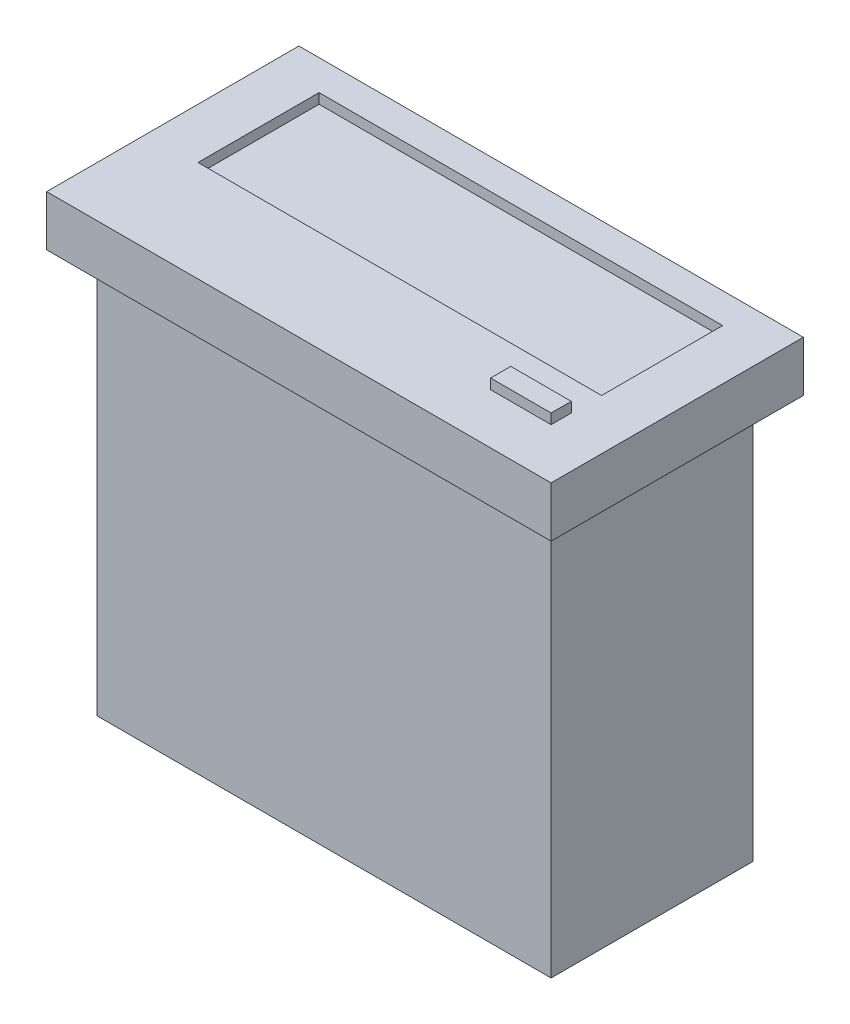
from build123d import *

# Parameters (mm, degrees)
SKETCH1_W           = 50
SKETCH1_H           = 25
BOSS_EXTRUDE1_DEPTH = 5
SKETCH2_W           = 45
SKETCH2_H           = 20
BOSS_EXTRUDE2_DEPTH = 40
SKETCH3_W           = 40
SKETCH3_H           = 12
CUT_EXTRUDE1_DEPTH  = 1
SKETCH4_W           = 6
SKETCH4_H           = 2
BOSS_EXTRUDE3_DEPTH = 1


with BuildPart() as part:
    # Sketch1 → Boss-Extrude1 (new body)
    with BuildSketch(Plane(origin=(0, 0, 0), x_dir=(1, 0, 0), z_dir=(0, 1, 0))):
        with Locations((25, 12.5)):
            Rectangle(SKETCH1_W, SKETCH1_H)
    extrude(amount=-BOSS_EXTRUDE1_DEPTH)

    # Sketch2 → Boss-Extrude2 (add)
    with BuildSketch(Plane.XZ.offset(5)):
        with Locations((25, -12.5)):
            Rectangle(SKETCH2_W, SKETCH2_H)
    extrude(amount=BOSS_EXTRUDE2_DEPTH)

    # Sketch3 → Cut-Extrude1 (cut)
    with BuildSketch(Plane(origin=(0, 0, 0), x_dir=(1, 0, 0), z_dir=(0, 1, 0))):
        with Locations((25, 16)):
            Rectangle(SKETCH3_W, SKETCH3_H)
    extrude(amount=-CUT_EXTRUDE1_DEPTH, mode=Mode.SUBTRACT)

    # Sketch4 → Boss-Extrude3 (add)
    with BuildSketch(Plane(origin=(0, 0, 0), x_dir=(1, 0, 0), z_dir=(0, 1, 0))):
        with Locations((42, 6)):
            Rectangle(SKETCH4_W, SKETCH4_H)
    extrude(amount=BOSS_EXTRUDE3_DEPTH)


solid = part.part
